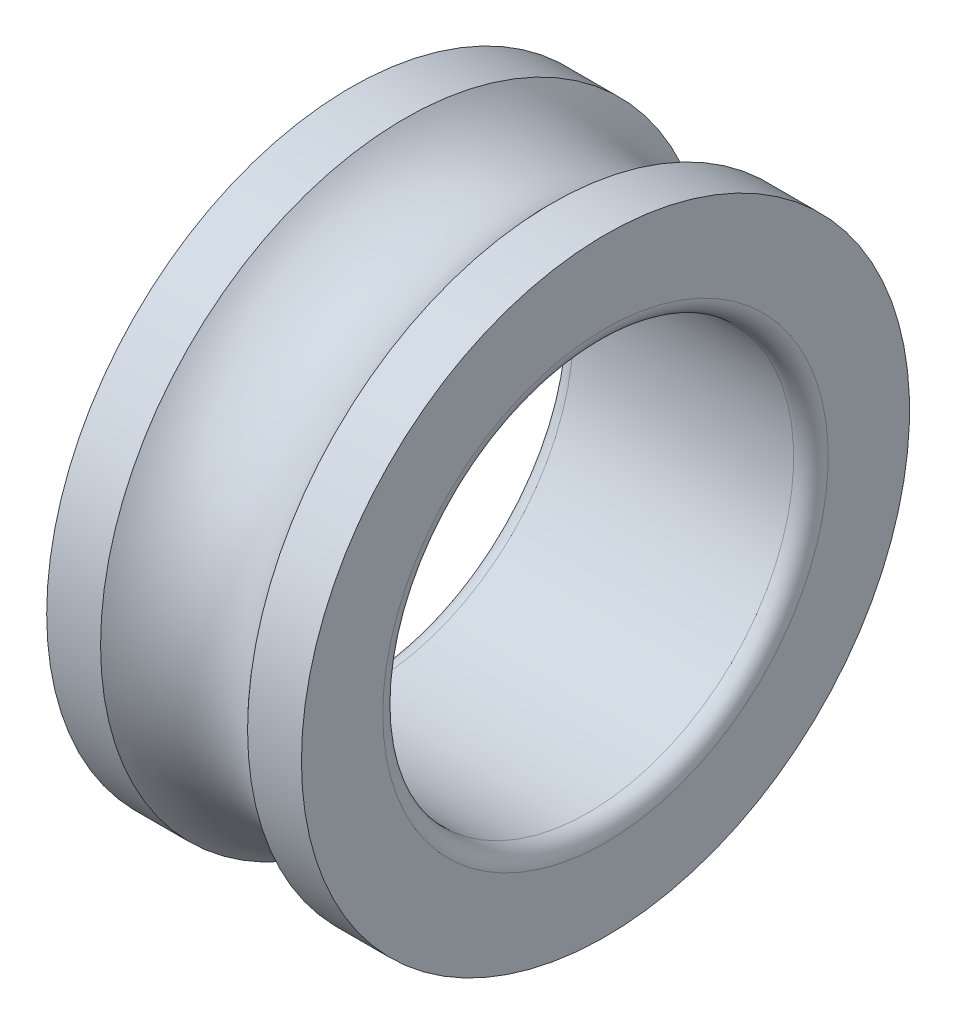
from build123d import *


with BuildPart() as part:
    # Sketch1 → Revolve1 (revolve)
    with BuildSketch(Plane.XY, mode=Mode.PRIVATE) as revolve1_sk:
        with BuildLine():
            Line((-15.5, 37), (-8.94427191, 37))
            ThreePointArc((-8.94427191, 37), (0, 33), (8.94427191, 37))
            Line((8.94427191, 37), (15.5, 37))
            Line((15.5, 37), (15.5, 27.1))
            ThreePointArc((15.5, 27.1), (14.88492424, 25.61507576), (13.4, 25))
            Line((13.4, 25), (-13.4, 25))
            ThreePointArc((-13.4, 25), (-14.88492424, 25.61507576), (-15.5, 27.1))
            Line((-15.5, 27.1), (-15.5, 37))
        make_face()
    revolve(revolve1_sk.sketch.rotate(Axis((-22.718932343, 0, 0), (1, 0, 0)), 90), axis=Axis((-22.718932343, 0, 0), (1, 0, 0)))


solid = part.part
